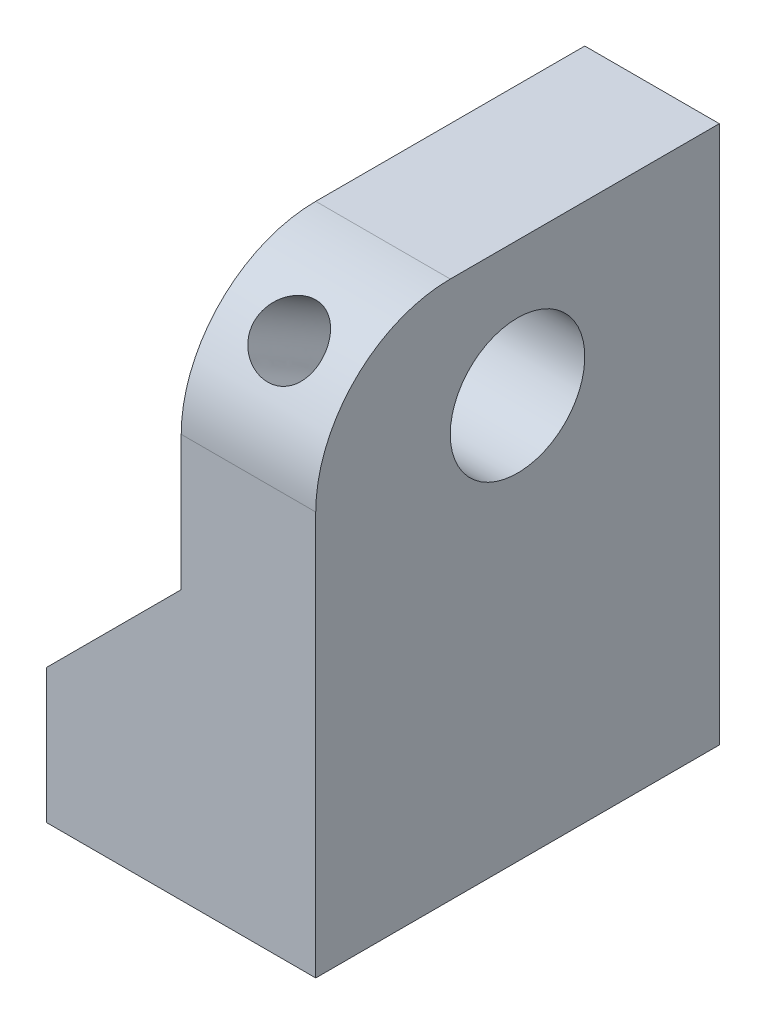
from build123d import *

# Parameters (mm, degrees)
BOSS_EXTRUDE1_DEPTH = 76.2
FILLET1_R           = 25.4
SKETCH2_R           = 12.7
CUT_EXTRUDE1_DEPTH  = 252.476
SKETCH7_R           = 6.35


with BuildPart() as part:
    # Sketch1 → Boss-Extrude1 (new body)
    with BuildSketch(Plane.XY):
        Polygon((0, 0), (50.8, 0), (50.8, 101.6), (25.4, 101.6), (25.4, 50.8), (0, 25.4), align=None)
    extrude(amount=BOSS_EXTRUDE1_DEPTH)

    # Fillet1
    fillet1_edges = [part.edges().sort_by_distance(p)[0] for p in [
        (38.1, 101.6, 76.2),
    ]]
    fillet(fillet1_edges, radius=FILLET1_R)

    # Sketch2 → Cut-Extrude1 (cut, symmetric)
    with BuildSketch(Plane(origin=(0, 0, 0), x_dir=(0, 0, -1), z_dir=(1, 0, 0))):
        with Locations((-38.1, 76.2)):
            Circle(SKETCH2_R)
    extrude(amount=CUT_EXTRUDE1_DEPTH, both=True, mode=Mode.SUBTRACT)

    # Cut-Sweep1: sweep along a path in Sketch4
    with BuildLine(Plane(origin=(38.1, 0, -38.1), x_dir=(0, 0, 1), z_dir=(-1, 0, 0))) as cut_sweep1_path:
        Line((76.2, 76.2), (106.860512242, 94.160512242))
    # Sketch7 → Cut-Sweep1 (sweep, cut)
    with BuildSketch(Plane(origin=(38.1, 94.160512242, 68.760512242), x_dir=(1, 0, 0), z_dir=(0, 0.7071067811865479, 0.7071067811865472))):
        Circle(SKETCH7_R)
    sweep(path=cut_sweep1_path.line, mode=Mode.SUBTRACT)


solid = part.part
